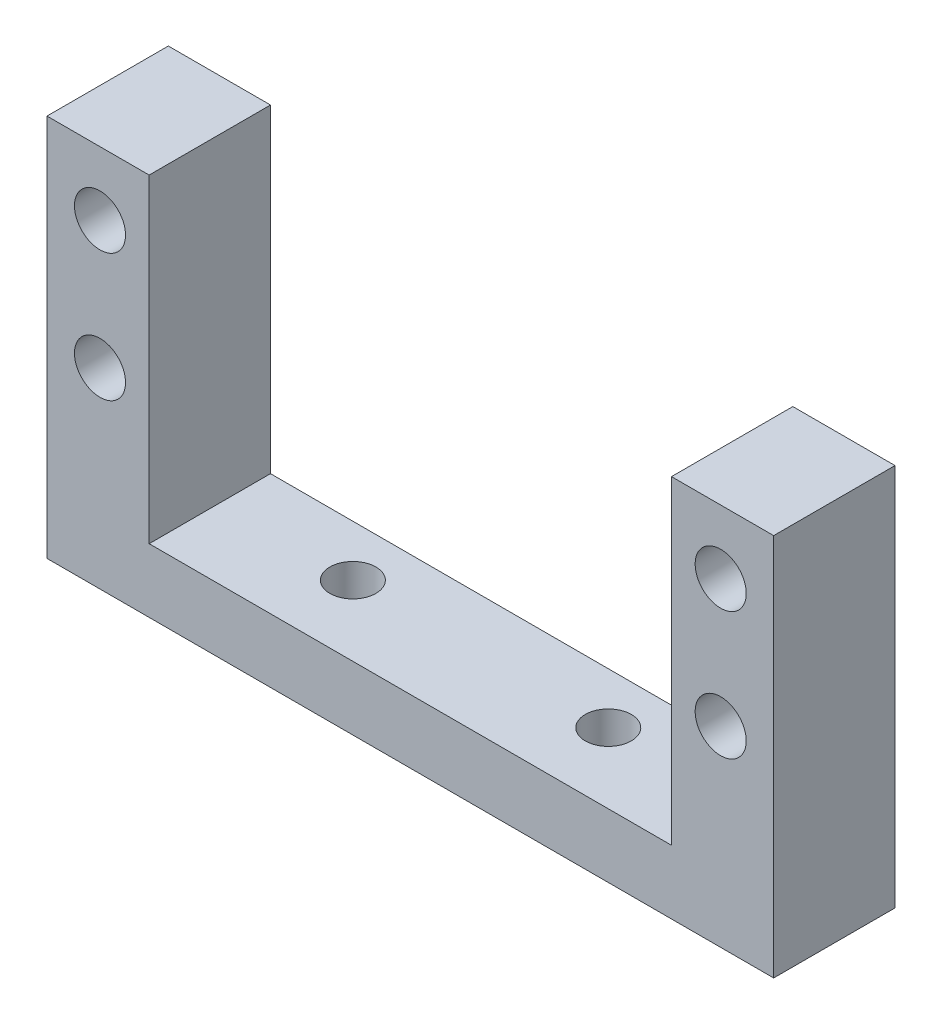
from build123d import *

# Parameters (mm, degrees)
ESQUISSE1_W             = 40.9
ESQUISSE1_H             = 5
ESQUISSE1_W_2           = 8
ESQUISSE1_H_2           = 30
ESQUISSE1_R             = 2
BOSS_EXTRU_1_DEPTH      = 11
ESQUISSE2_R             = 1.8
ENL_V_MAT_EXTRU_1_DEPTH = 9
ESQUISSE3_W             = 56.9
ESQUISSE3_H             = 30
ENL_V_MAT_EXTRU_2_DEPTH = 1.5


with BuildPart() as part:
    # Esquisse1 → Boss.-Extru.1 (new body)
    # profile 1 of 3: a face of its own
    with BuildSketch(Plane.XY):
        with Locations((28.45, 2.5)):
            Rectangle(ESQUISSE1_W, ESQUISSE1_H)
    # profile 2 of 3: a face of its own
    with BuildSketch(Plane.XY):
        with Locations((4, 15)):
            Rectangle(ESQUISSE1_W_2, ESQUISSE1_H_2)
        with Locations((4.15, 15)):
            Circle(ESQUISSE1_R, mode=Mode.SUBTRACT)
        with Locations((4.15, 25)):
            Circle(ESQUISSE1_R, mode=Mode.SUBTRACT)
    # profile 3 of 3: a face of its own
    with BuildSketch(Plane.XY):
        Polygon((48.9, 5), (48.9, 0), (56.9, 0), (56.9, 30), (48.9, 30), align=None)
        with Locations((52.75, 15)):
            Circle(ESQUISSE1_R, mode=Mode.SUBTRACT)
        with Locations((52.75, 25)):
            Circle(ESQUISSE1_R, mode=Mode.SUBTRACT)
    extrude(amount=BOSS_EXTRU_1_DEPTH)

    # Esquisse2 → Enlèv. mat.-Extru.1 (cut)
    with BuildSketch(Plane.XZ):
        with Locations((18.45, 4)):
            Circle(ESQUISSE2_R)
        with Locations((38.45, 4)):
            Circle(ESQUISSE2_R)
    extrude(amount=-ENL_V_MAT_EXTRU_1_DEPTH, mode=Mode.SUBTRACT)

    # Esquisse3 → Enlèv. mat.-Extru.2 (cut)
    with BuildSketch(Plane.XY.offset(11)):
        with Locations((28.45, 15)):
            Rectangle(ESQUISSE3_W, ESQUISSE3_H)
    extrude(amount=-ENL_V_MAT_EXTRU_2_DEPTH, mode=Mode.SUBTRACT)


solid = part.part
